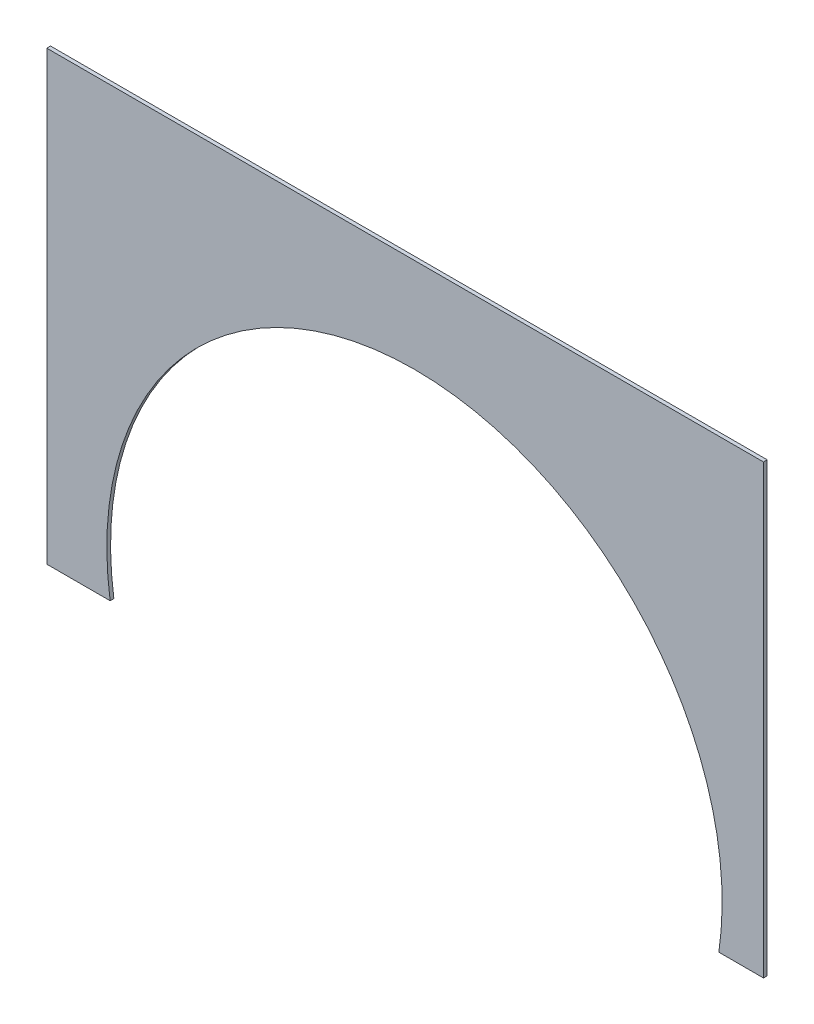
from build123d import *

# Parameters (mm, degrees)
EXTRUDE_1_DEPTH = 0.5


with BuildPart() as part:
    # Эскиз1 → Вытянуть1 (new body)
    with BuildSketch(Plane.XY):
        with BuildLine():
            Line((2.063762187, -60), (10.569656745, -60))
            ThreePointArc((10.569656745, -60), (51.430925196, -12.664111557), (92.292193648, -60))
            Line((92.292193648, -60), (98.287869977, -60))
            Line((98.287869977, -60), (98.287869977, 0))
            Line((98.287869977, 0), (2.063762187, 0))
            Line((2.063762187, 0), (2.063762187, -60))
        make_face()
    extrude(amount=EXTRUDE_1_DEPTH)


solid = part.part
